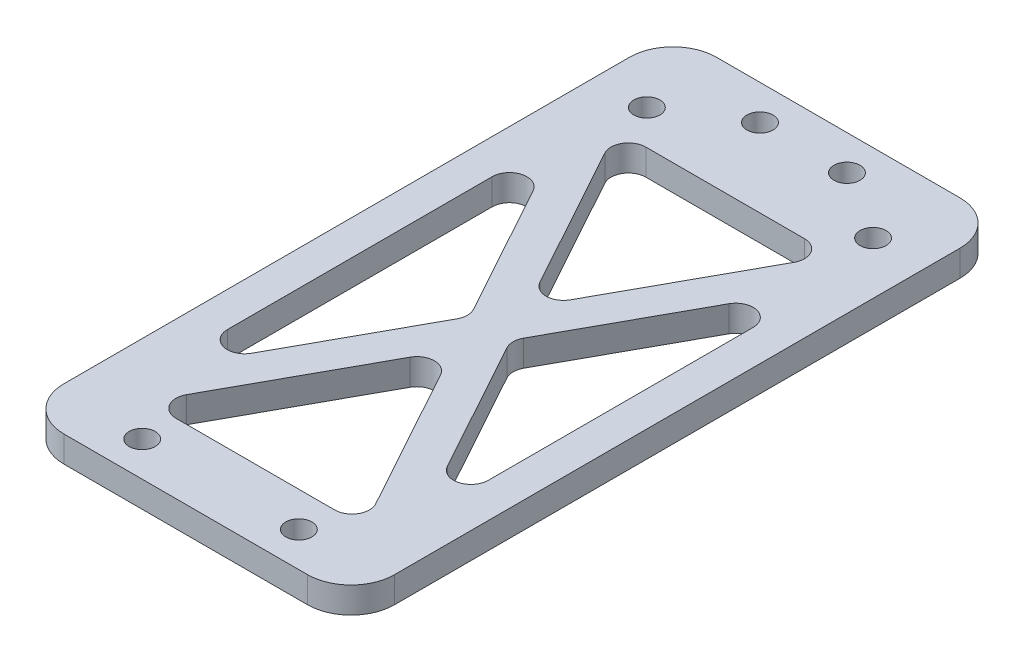
from build123d import *

# Parameters (mm, degrees)
SKETCH_1_W          = 38
SKETCH_1_H          = 70
SKETCH_1_R          = 1.5
SKETCH_1_W_2        = 30
SKETCH_1_H_2        = 54
SKETCH_1_H_3        = 5
EXTRUDE_1_DEPTH     = 3
EXTRUDE_2_DEPTH     = 3
FILLET_1_R          = 2
SKETCH_4_R          = 1.5
CUT_EXTRUDE_1_DEPTH = 10
FILLET_2_R          = 5


with BuildPart() as part:
    # 草图1 → 凸台-拉伸1 (new body)
    # profile 1 of 2: a face of its own
    with BuildSketch(Plane(origin=(0, 0, 0), x_dir=(1, 0, 0), z_dir=(0, 1, 0))):
        Rectangle(SKETCH_1_W, SKETCH_1_H)
        with Locations(Location((13, 31, 0), (0, 0, 270))):
            Circle(SKETCH_1_R, mode=Mode.SUBTRACT)
        with Locations(Location((-13, 31, 0), (0, 0, 270))):
            Circle(SKETCH_1_R, mode=Mode.SUBTRACT)
        with Locations(Location((9, -31, 0), (0, 0, 270))):
            Circle(SKETCH_1_R, mode=Mode.SUBTRACT)
        with Locations(Location((-9, -31, 0), (0, 0, 270))):
            Circle(SKETCH_1_R, mode=Mode.SUBTRACT)
        Rectangle(SKETCH_1_W_2, SKETCH_1_H_2, mode=Mode.SUBTRACT)
    # profile 2 of 2: a face of its own
    with BuildSketch(Plane(origin=(0, 0, 0), x_dir=(1, 0, 0), z_dir=(0, 1, 0))):
        with Locations((0, 37.5)):
            Rectangle(SKETCH_1_W, SKETCH_1_H_3)
    extrude(amount=EXTRUDE_1_DEPTH)

    # 草图2 → 凸台-拉伸2 (add)
    with BuildSketch(Plane(origin=(0, 3, 0), x_dir=(1, 0, 0), z_dir=(0, 1, 0))):
        Polygon((15, 27), (12.5, 27), (0, 4.272727273), (-12.5, 27), (-15, 27), (-15, 23), (-2.35, 0), (-15, -23), (-15, -27), (-12.5, -27), (0, -4.272727273), (12.5, -27), (15, -27), (15, -23), (2.35, 0), (15, 23), align=None)
    extrude(amount=-EXTRUDE_2_DEPTH)

    # 圆角1
    fillet_1_edges = [part.edges().sort_by_distance(p)[0] for p in [
        (-2.35, 1.5, 0),
        (-15, 1.5, -23),
        (-12.5, 1.5, -27),
        (0, 1.5, -4.272727273),
        (12.5, 1.5, -27),
        (15, 1.5, -23),
        (2.35, 1.5, 0),
        (15, 1.5, 23),
        (12.5, 1.5, 27),
        (0, 1.5, 4.272727273),
        (-12.5, 1.5, 27),
        (-15, 1.5, 23),
    ]]
    fillet(fillet_1_edges, radius=FILLET_1_R)

    # 草图4 → 切除-拉伸1 (cut)
    with BuildSketch(Plane(origin=(0, 3, 0), x_dir=(1, 0, 0), z_dir=(0, 1, 0))):
        with Locations(Location((-5, 36, 0), (0, 0, 270))):
            Circle(SKETCH_4_R)
        with Locations(Location((5, 36, 0), (0, 0, 270))):
            Circle(SKETCH_4_R)
    extrude(amount=-CUT_EXTRUDE_1_DEPTH, mode=Mode.SUBTRACT)

    # 圆角2
    fillet_2_edges = [part.edges().sort_by_distance(p)[0] for p in [
        (-19, 1.5, 35),
        (-19, 1.5, -40),
        (19, 1.5, -40),
        (19, 1.5, 35),
    ]]
    fillet(fillet_2_edges, radius=FILLET_2_R)


solid = part.part
